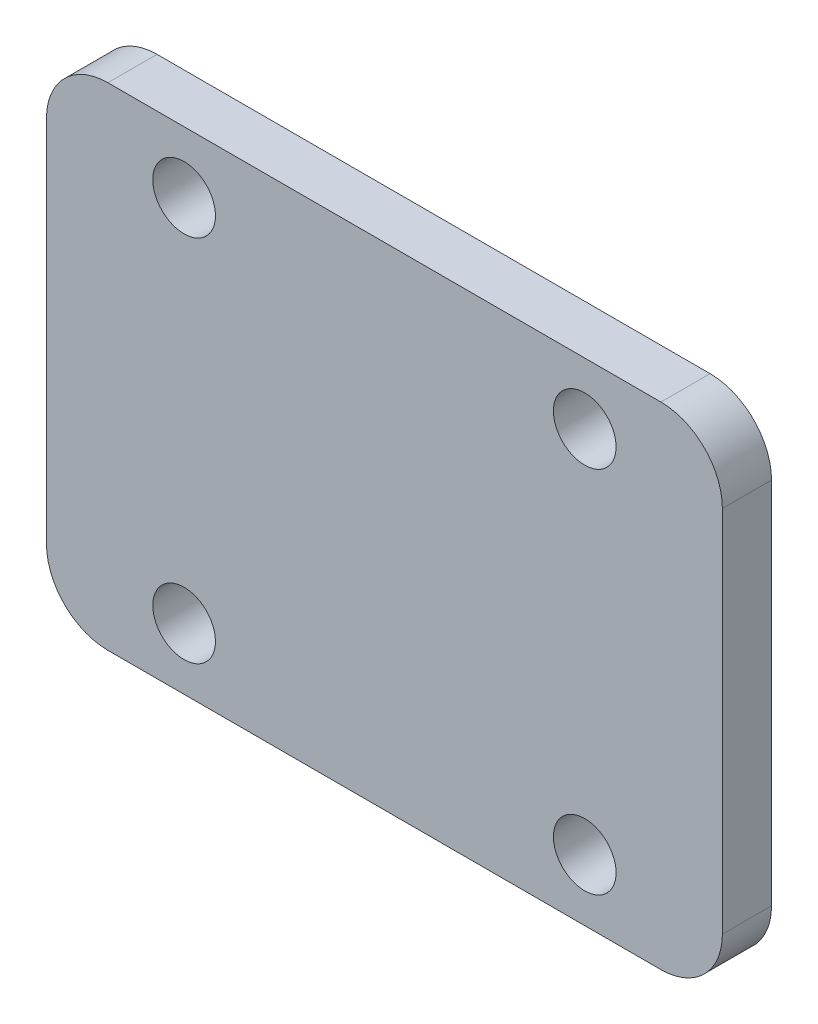
from build123d import *

# Parameters (mm, degrees)
SKETCH2_R           = 2.55
BOSS_EXTRUDE1_DEPTH = 4


with BuildPart() as part:
    # Sketch2 → Boss-Extrude1 (new body)
    with BuildSketch(Plane.XY):
        with BuildLine():
            Line((-22.5, -20), (22.5, -20))
            ThreePointArc((22.5, -20), (26.035533906, -18.535533906), (27.5, -15))
            Line((27.5, -15), (27.5, 15))
            ThreePointArc((27.5, 15), (26.035533906, 18.535533906), (22.5, 20))
            Line((22.5, 20), (-22.5, 20))
            ThreePointArc((-22.5, 20), (-26.035533906, 18.535533906), (-27.5, 15))
            Line((-27.5, 15), (-27.5, -15))
            ThreePointArc((-27.5, -15), (-26.035533906, -18.535533906), (-22.5, -20))
        make_face()
        with Locations((-16.3, 15)):
            Circle(SKETCH2_R, mode=Mode.SUBTRACT)
        with Locations(Location((-16.3, -15, 0), (0, 0, 180))):
            Circle(SKETCH2_R, mode=Mode.SUBTRACT)
        with Locations((16.3, -15)):
            Circle(SKETCH2_R, mode=Mode.SUBTRACT)
        with Locations(Location((16.3, 15, 0), (0, 0, 180))):
            Circle(SKETCH2_R, mode=Mode.SUBTRACT)
    extrude(amount=BOSS_EXTRUDE1_DEPTH)


solid = part.part
